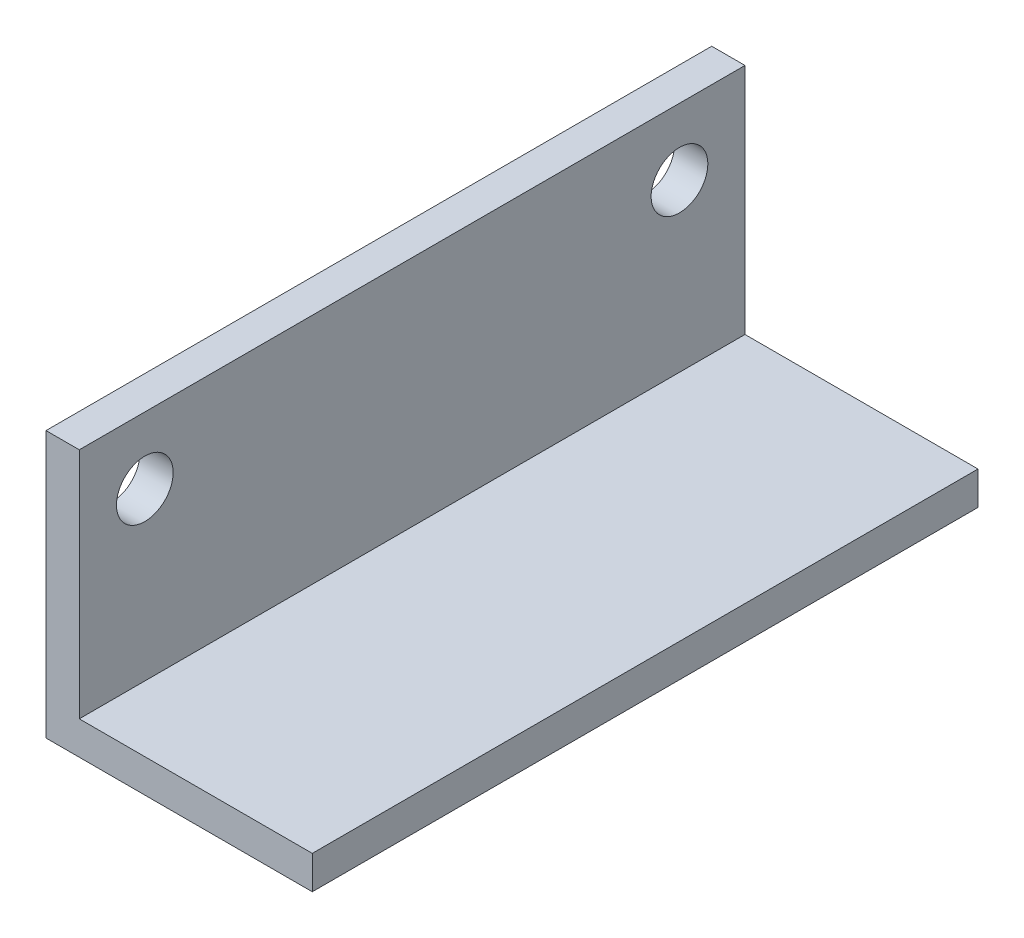
from build123d import *

# Parameters (mm, degrees)
BOSS_EXTRUDE1_DEPTH = 63.5
SKETCH4_R           = 2.705
CUT_EXTRUDE3_DEPTH  = 72.912172996


with BuildPart() as part:
    # Sketch1 → Boss-Extrude1 (new body)
    with BuildSketch(Plane.XY):
        Polygon((0, 0), (25.4, 0), (25.4, 3.175), (3.175, 3.175), (3.175, 25.4), (0, 25.4), align=None)
    extrude(amount=BOSS_EXTRUDE1_DEPTH)

    # Sketch4 → Cut-Extrude3 (cut, through all)
    with BuildSketch(Plane(origin=(3.175, 0, 0), x_dir=(0, 0, -1), z_dir=(1, 0, 0))):
        with Locations((-57.25, 19.05)):
            Circle(SKETCH4_R)
        with Locations((-6.25, 19.05)):
            Circle(SKETCH4_R)
    extrude(amount=-CUT_EXTRUDE3_DEPTH, mode=Mode.SUBTRACT)


solid = part.part
